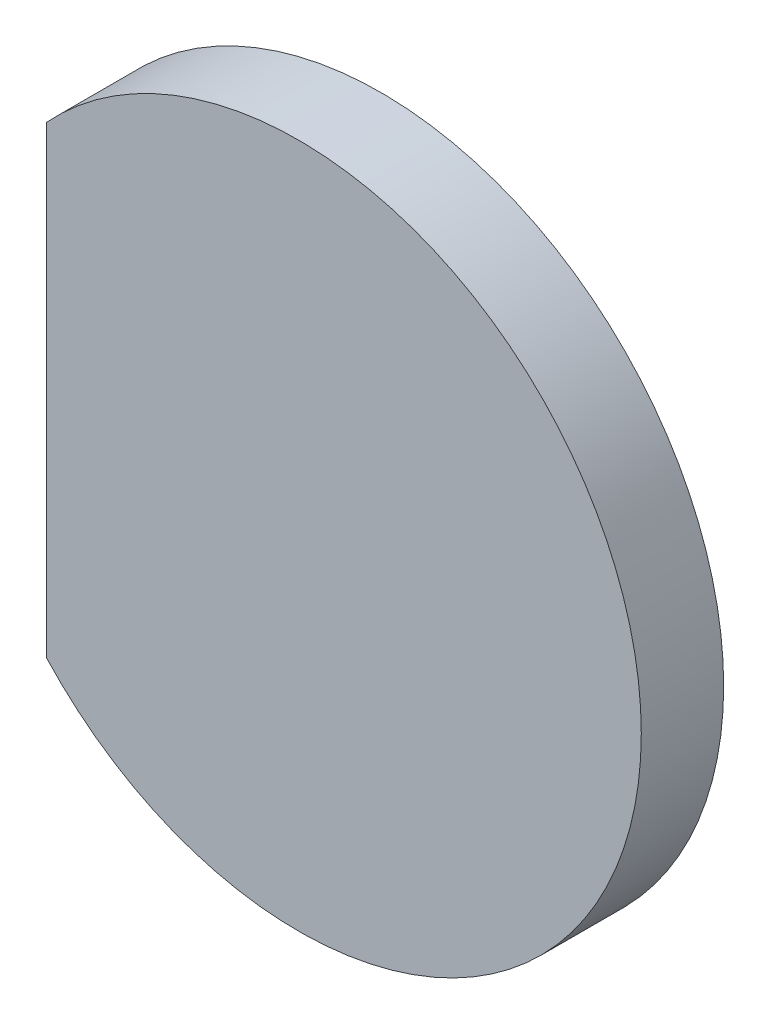
from build123d import *

# Parameters (mm, degrees)
BOSS_EXTRUDE1_DEPTH = 14.017


with BuildPart() as part:
    # Sketch1 → Boss-Extrude1 (new body)
    with BuildSketch(Plane.XY):
        with BuildLine():
            Line((-42.935515035, 39.4175), (-42.935515035, -39.4175))
            ThreePointArc((-42.935515035, -39.4175), (58.285484965, 0), (-42.935515035, 39.4175))
        make_face()
    extrude(amount=BOSS_EXTRUDE1_DEPTH)


solid = part.part
